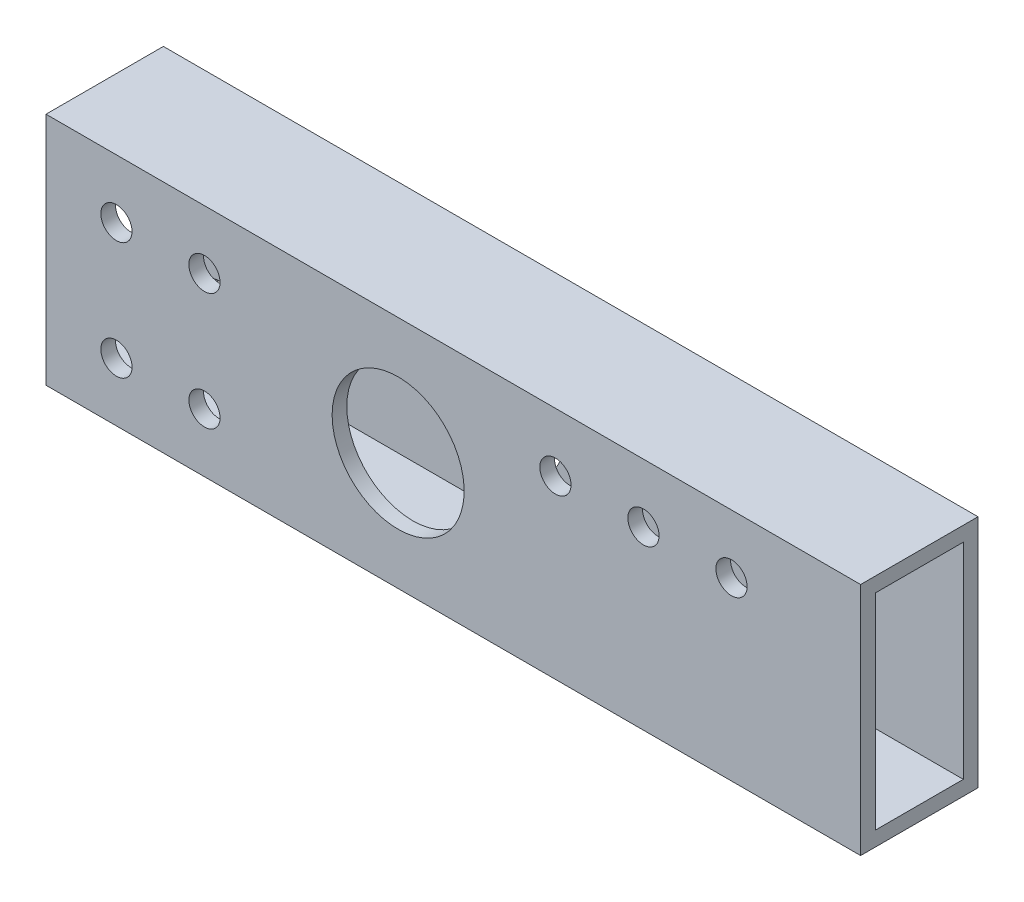
from build123d import *

# Parameters (mm, degrees)
SKETCH1_W           = 176.276
SKETCH1_H           = 25.4
BOSS_EXTRUDE1_DEPTH = 50.8
SKETCH2_OUTSIDE_W   = 64.44
SKETCH2_OUTSIDE_H   = 89.84
SKETCH2_OUTSIDE_W_2 = 25.4
SKETCH2_OUTSIDE_H_2 = 50.8
SKETCH2_OUTSIDE_W_3 = 19.05
SKETCH2_OUTSIDE_H_3 = 44.45
CUT_EXTRUDE1_DEPTH  = 186.199968078
SKETCH3_R           = 14.2875
CUT_EXTRUDE2_DEPTH  = 186.199968078
SKETCH4_R           = 3.3782
CUT_EXTRUDE3_DEPTH  = 186.199968078
SKETCH5_R           = 3.3782
CUT_EXTRUDE4_DEPTH  = 186.199968078


with BuildPart() as part:
    # Sketch1 → Boss-Extrude1 (new body)
    with BuildSketch(Plane(origin=(0, 0, 0), x_dir=(1, 0, 0), z_dir=(0, 1, 0))):
        with Locations((88.138, 12.7)):
            Rectangle(SKETCH1_W, SKETCH1_H)
    extrude(amount=BOSS_EXTRUDE1_DEPTH)

    # Sketch2 outside → Cut-Extrude1 (cut, through all)
    # profile 1 of 2: a face of its own
    with BuildSketch(Plane(origin=(176.276, 0, 0), x_dir=(0, 0, -1), z_dir=(1, 0, 0))):
        with Locations((12.7, 25.4)):
            Rectangle(SKETCH2_OUTSIDE_W, SKETCH2_OUTSIDE_H)
        with Locations((12.7, 25.4)):
            Rectangle(SKETCH2_OUTSIDE_W_2, SKETCH2_OUTSIDE_H_2, mode=Mode.SUBTRACT)
    # profile 2 of 2: a face of its own
    with BuildSketch(Plane(origin=(176.276, 0, 0), x_dir=(0, 0, -1), z_dir=(1, 0, 0))):
        with Locations((12.7, 25.4)):
            Rectangle(SKETCH2_OUTSIDE_W_3, SKETCH2_OUTSIDE_H_3)
    extrude(amount=-CUT_EXTRUDE1_DEPTH, mode=Mode.SUBTRACT)

    # Sketch3 → Cut-Extrude2 (cut, through all)
    with BuildSketch(Plane(origin=(0, 0, -25.4), x_dir=(-1, 0, 0), z_dir=(0, 0, -1))):
        with Locations((-76.2, 25.4)):
            Circle(SKETCH3_R)
    extrude(amount=-CUT_EXTRUDE2_DEPTH, mode=Mode.SUBTRACT)

    # Sketch4 → Cut-Extrude3 (cut, through all)
    with BuildSketch(Plane.XY):
        with Locations((148.336, 38.1)):
            Circle(SKETCH4_R)
        with Locations((129.286, 38.1)):
            Circle(SKETCH4_R)
        with Locations((110.236, 38.1)):
            Circle(SKETCH4_R)
    extrude(amount=-CUT_EXTRUDE3_DEPTH, mode=Mode.SUBTRACT)

    # Sketch5 → Cut-Extrude4 (cut, through all)
    with BuildSketch(Plane.XY):
        with Locations((15.24, 38.1)):
            Circle(SKETCH5_R)
        with Locations((15.24, 12.7)):
            Circle(SKETCH5_R)
        with Locations((34.29, 12.7)):
            Circle(SKETCH5_R)
        with Locations((34.29, 38.1)):
            Circle(SKETCH5_R)
    extrude(amount=-CUT_EXTRUDE4_DEPTH, mode=Mode.SUBTRACT)


solid = part.part
